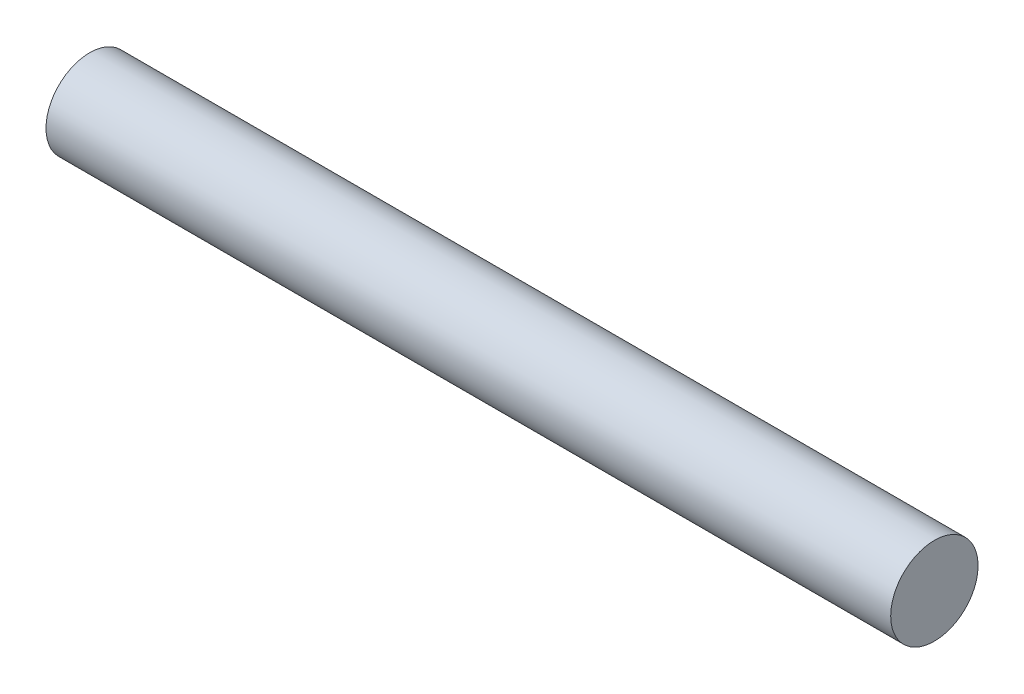
from build123d import *

# Parameters (mm, degrees)
SKETCH1_R           = 6
BOSS_EXTRUDE1_DEPTH = 116


with BuildPart() as part:
    # Sketch1 → Boss-Extrude1 (new body)
    with BuildSketch(Plane(origin=(0, 0, 0), x_dir=(0, 0, -1), z_dir=(1, 0, 0))):
        with Locations(Location((0, 0, 0), (0, 0, 180))):
            Circle(SKETCH1_R)
    extrude(amount=BOSS_EXTRUDE1_DEPTH)


solid = part.part
